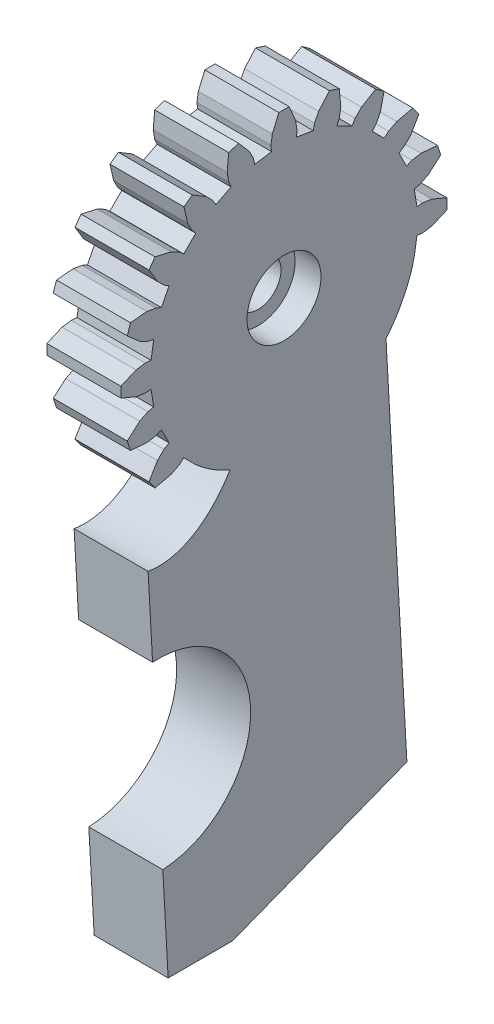
from build123d import *

# Parameters (mm, degrees)
BOSS_EXTRUDE1_DEPTH = 10
SKETCH3_R           = 3.1
CUT_EXTRUDE1_DEPTH  = 10
CUT_EXTRUDE4_DEPTH  = 10
BOSS_EXTRUDE2_DEPTH = 10
SKETCH9_R           = 5
CUT_EXTRUDE5_DEPTH  = 3.5


with BuildPart() as part:
    # Sketch1 → Boss-Extrude1 (new body)
    with BuildSketch(Plane.YZ):
        Polygon((122.8604, 156.33104), (123.6529, 156.40531), (124.8827, 156.22038), (126.9389, 155.34362), (126.9389, 153.95038), (124.8827, 153.07362), (123.6529, 152.88869), (122.8604, 152.96296), (122.5013, 150.69576), (123.278, 150.5215), (124.3904, 149.9656), (126.075, 148.49636), (125.6445, 147.1713), (123.418, 146.97285), (122.1913, 147.17699), (121.4605, 147.49252), (120.4184, 145.44725), (121.1032, 145.04152), (121.9894, 144.1691), (123.1376, 142.2512), (122.3186, 141.124), (120.1398, 141.6233), (119.0362, 142.1965), (118.4387, 142.7224), (116.8156, 141.0993), (117.3415, 140.5018), (117.9147, 139.3982), (118.414, 137.2194), (117.2868, 136.4004), (115.3689, 137.5486), (114.49648, 138.4348), (114.09075, 139.1196), (112.04548, 138.0775), (112.36101, 137.3467), (112.56515, 136.12), (112.3667, 133.8935), (111.04164, 133.463), (109.5724, 135.1476), (109.0165, 136.26), (108.84224, 137.0367), (106.57504, 136.6776), (106.64931, 135.8851), (106.46438, 134.6553), (105.58762, 132.5991), (104.19438, 132.5991), (103.31762, 134.6553), (103.13269, 135.8851), (103.20696, 136.6776), (100.93976, 137.0367), (100.7655, 136.26), (100.2096, 135.1476), (98.74036, 133.463), (97.4153, 133.8935), (97.21685, 136.12), (97.42099, 137.3467), (97.73652, 138.0775), (95.69125, 139.1196), (95.28552, 138.4348), (94.4131, 137.5486), (92.4952, 136.4004), (91.368, 137.2194), (91.8673, 139.3982), (92.4405, 140.5018), (92.9664, 141.0993), (91.3433, 142.7224), (90.7458, 142.1965), (89.6422, 141.6233), (87.4634, 141.124), (86.6444, 142.2512), (87.7926, 144.1691), (88.6788, 145.04152), (89.3636, 145.44725), (88.3215, 147.49252), (87.5907, 147.17699), (86.364, 146.97285), (84.1375, 147.1713), (83.707, 148.49636), (85.3916, 149.9656), (86.504, 150.5215), (87.2807, 150.69576), (86.9216, 152.96296), (86.1291, 152.88869), (84.8993, 153.07362), (82.8431, 153.95038), (82.8431, 155.34362), (84.8993, 156.22038), (86.1291, 156.40531), (86.9216, 156.33104), (87.2807, 158.59824), (86.504, 158.7725), (85.3916, 159.3284), (83.707, 160.79764), (84.1375, 162.1227), (86.364, 162.32115), (87.5907, 162.11701), (88.3215, 161.80148), (89.3636, 163.84675), (88.6788, 164.25248), (87.7926, 165.1249), (86.6444, 167.0428), (87.4634, 168.17), (89.6422, 167.6707), (90.7458, 167.0975), (91.3433, 166.5716), (92.9664, 168.1947), (92.4405, 168.7922), (91.8673, 169.8958), (91.368, 172.0746), (92.4952, 172.8936), (94.4131, 171.7454), (95.28552, 170.8592), (95.69125, 170.1744), (97.73652, 171.2165), (97.42099, 171.9473), (97.21685, 173.174), (97.4153, 175.4005), (98.74036, 175.831), (100.2096, 174.1464), (100.7655, 173.034), (100.93976, 172.2573), (103.20696, 172.6164), (103.13269, 173.4089), (103.31762, 174.6387), (104.19438, 176.6949), (105.58762, 176.6949), (106.46438, 174.6387), (106.64931, 173.4089), (106.57504, 172.6164), (108.84224, 172.2573), (109.0165, 173.034), (109.5724, 174.1464), (111.04164, 175.831), (112.3667, 175.4005), (112.56515, 173.174), (112.36101, 171.9473), (112.04548, 171.2165), (114.09075, 170.1744), (114.49648, 170.8592), (115.3689, 171.7454), (117.2868, 172.8936), (118.414, 172.0746), (117.9147, 169.8958), (117.3415, 168.7922), (116.8156, 168.1947), (118.4387, 166.5716), (119.0362, 167.0975), (120.1398, 167.6707), (122.3186, 168.17), (123.1376, 167.0428), (121.9894, 165.1249), (121.1032, 164.25248), (120.4184, 163.84675), (121.4605, 161.80148), (122.1913, 162.11701), (123.418, 162.32115), (125.6445, 162.1227), (126.075, 160.79764), (124.3904, 159.3284), (123.278, 158.7725), (122.5013, 158.59824), align=None)
    extrude(amount=BOSS_EXTRUDE1_DEPTH)

    # Sketch3 → Cut-Extrude1 (cut)
    with BuildSketch(Plane.YZ.offset(10)):
        with Locations(Location((104.891, 154.647, 0), (0, 0, 270))):
            Circle(SKETCH3_R)
    extrude(amount=-CUT_EXTRUDE1_DEPTH, mode=Mode.SUBTRACT)

    # Sketch5 → Cut-Extrude4 (cut)
    with BuildSketch(Plane.YZ.offset(10)):
        with BuildLine():
            Line((92.9664, 168.1947), (90.294048938, 171.230794333))
            ThreePointArc((90.294048938, 171.230794333), (83.487848916, 149.169926106), (100.054261516, 133.090117674))
            Line((100.054261516, 133.090117674), (100.93976, 137.0367))
            ThreePointArc((100.93976, 137.0367), (87.406270735, 150.172651628), (92.9664, 168.1947))
        make_face()
    extrude(amount=-CUT_EXTRUDE4_DEPTH, mode=Mode.SUBTRACT)


with BuildPart() as cut_extrude4_kept_piece:
    # of the separate pieces the step leaves, the one the design keeps (cut_extrude4_pieces_kept)
    add(part.part.solids().sort_by_distance((0, 122.8604, 156.33104))[0])

    # Sketch8 → Boss-Extrude2 (add)
    with BuildSketch(Plane(origin=(0, 0, 0), x_dir=(0, -1, 0), z_dir=(-1, 0, 0))):
        with BuildLine():
            Line((-101.292796156, 158.234170992), (-100.358785712, 141.250463774))
            Line((-100.358785712, 141.250463774), (-42.28117848, 138.036732938))
            Line((-42.28117848, 138.036732938), (-33.120005133, 161.580447331))
            Line((-33.120005133, 161.580447331), (-33.120005133, 170.304878432))
            Line((-33.120005133, 170.304878432), (-46.164559873, 171.026700315))
            ThreePointArc((-46.164559873, 171.026700315), (-59.339432356, 159.173287387), (-71.126053545, 172.407947335))
            Line((-71.126053545, 172.407947335), (-82.067282372, 173.013381445))
            add(Edge.make_bspline(
                [(-101.292796156, 158.234170992), (-79.754841913, 159.418639963), (-82.067282372, 173.013381445)],
                knots=[4.799124848, 4.799124848, 4.799124848, 6.390352549, 6.390352549, 6.390352549], degree=2, weights=[1, 0.699846429, 1]))
        make_face()
    extrude(amount=-BOSS_EXTRUDE2_DEPTH)

    # Sketch9 → Cut-Extrude5 (cut)
    with BuildSketch(Plane.YZ.offset(10)):
        with Locations(Location((104.891, 154.647, 0), (0, 0, 270))):
            Circle(SKETCH9_R)
    extrude(amount=-CUT_EXTRUDE5_DEPTH, mode=Mode.SUBTRACT)


solid = cut_extrude4_kept_piece.part
